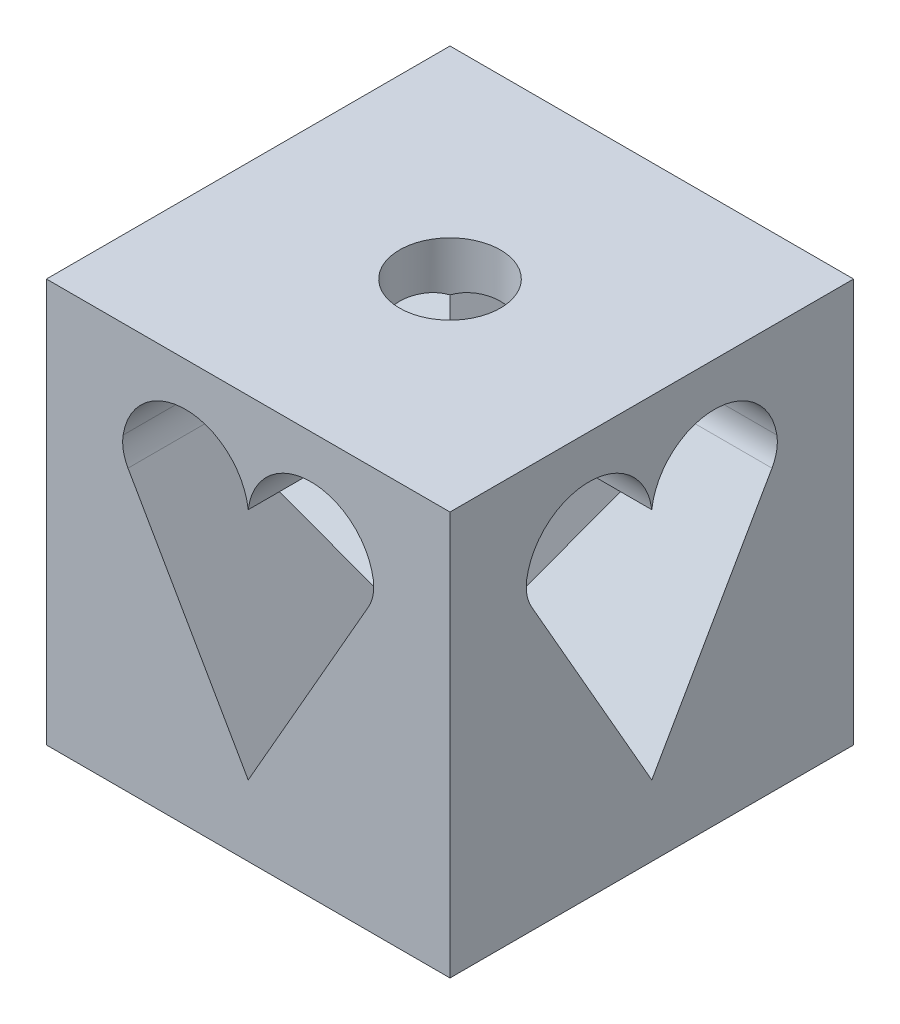
from build123d import *

# Parameters (mm, degrees)
SKETCH1_W           = 100
SKETCH1_H           = 100
BOSS_EXTRUDE1_DEPTH = 100
CUT_EXTRUDE1_DEPTH  = 50
CIRPATTERN2_COUNT   = 4
SKETCH3_R           = 12.5
CUT_EXTRUDE2_DEPTH  = 50


with BuildPart() as part:
    # Sketch1 → Boss-Extrude1 (new body)
    with BuildSketch(Plane(origin=(0, 0, 0), x_dir=(1, 0, 0), z_dir=(0, 1, 0))):
        Rectangle(SKETCH1_W, SKETCH1_H)
    extrude(amount=BOSS_EXTRUDE1_DEPTH)

    # Sketch2 → Cut-Extrude1 (cut)
    with BuildSketch(Plane.XY.offset(50)):
        with BuildLine():
            Line((0, 17.495781671), (-29.788286543, 69.516301586))
            ThreePointArc((-29.788286543, 69.516301586), (-30.943422674, 72.666080294), (-30.99180085, 76.020645087))
            ThreePointArc((-30.99180085, 76.020645087), (-15.265826761, 89.261609896), (0, 75.492661373))
            ThreePointArc((0, 75.492661373), (15.265826761, 89.261609896), (30.99180085, 76.020645087))
            ThreePointArc((30.99180085, 76.020645087), (30.943422674, 72.666080294), (29.788286543, 69.516301586))
            Line((29.788286543, 69.516301586), (0, 17.495781671))
        make_face()
    cut_extrude1 = extrude(amount=-CUT_EXTRUDE1_DEPTH, mode=Mode.SUBTRACT)

    # CirPattern2: Cut-Extrude1 ×4 about axis
    cirpattern2_axis = Axis((0, 105, 0), (0, -1, 0))
    for i in range(1, CIRPATTERN2_COUNT):
        add(cut_extrude1.rotate(cirpattern2_axis, i * 360 / CIRPATTERN2_COUNT), mode=Mode.SUBTRACT)

    # Sketch3 → Cut-Extrude2 (cut)
    with BuildSketch(Plane(origin=(0, 100, 0), x_dir=(1, 0, 0), z_dir=(0, 1, 0))):
        Circle(SKETCH3_R)
    extrude(amount=-CUT_EXTRUDE2_DEPTH, mode=Mode.SUBTRACT)


solid = part.part
